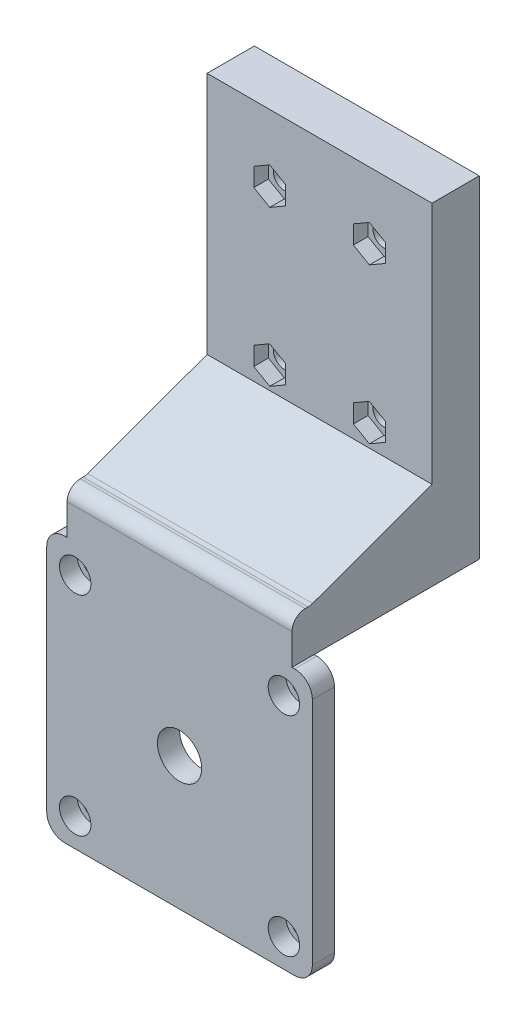
from build123d import *

# Parameters (mm, degrees)
SKETCH1_W           = 50.8
SKETCH1_H           = 65.000000038
SKETCH1_R           = 2.5
EXTRUDE_5_DEPTH     = 7.5
SKETCH1_3_W         = 50.8
SKETCH1_3_H         = 10
BOSS_EXTRUDE1_DEPTH = 34.125
BOSS_EXTRUDE2_START = 34.125
SKETCH1_4_R         = 2.25
BOSS_EXTRUDE2_DEPTH = 5
CHAMFER1_SIZE       = 10
CHAMFER1_SIZE2      = 27.474774195
FILLET1_R           = 3
SKETCH2_R           = 5
CUT_EXTRUDE1_DEPTH  = 144.721138443
SKETCH3_R           = 3.55
CUT_EXTRUDE2_DEPTH  = 4
CUT_EXTRUDE3_DEPTH  = 3.3
BOSS_EXTRUDE3_START = -3.18
SKETCH1_5_W         = 50.8
SKETCH1_5_H         = 65.000000038
SKETCH1_5_R         = 2.5
SKETCH1_5_H_2       = 10
BOSS_EXTRUDE3_DEPTH = 3.18


with BuildPart() as part:
    # Sketch1 → 5 (new body)
    with BuildSketch(Plane.XY):
        with Locations((0, 102.500000019)):
            Rectangle(SKETCH1_W, SKETCH1_H)
        with Locations((-11.25, 85.000000038)):
            Circle(SKETCH1_R, mode=Mode.SUBTRACT)
        with Locations((-11.25, 120.000000038)):
            Circle(SKETCH1_R, mode=Mode.SUBTRACT)
        with Locations((11.25, 85.000000038)):
            Circle(SKETCH1_R, mode=Mode.SUBTRACT)
        with Locations((11.25, 120.000000038)):
            Circle(SKETCH1_R, mode=Mode.SUBTRACT)
    extrude(amount=EXTRUDE_5_DEPTH)

    # Sketch1<3> → Boss-Extrude1 (add)
    with BuildSketch(Plane.XY):
        with Locations((0, 65)):
            Rectangle(SKETCH1_3_W, SKETCH1_3_H)
    extrude(amount=BOSS_EXTRUDE1_DEPTH)

    # Sketch1<4> → Boss-Extrude2 (add)
    with BuildSketch(Plane.XY.offset(BOSS_EXTRUDE2_START)):
        with BuildLine():
            Line((-25.4, 70), (-25.4, 60))
            Line((-25.4, 60), (-26, 60))
            ThreePointArc((-26, 60), (-28.828427125, 58.828427125), (-30, 56))
            Line((-30, 56), (-30, 4))
            ThreePointArc((-30, 4), (-28.828427125, 1.171572875), (-26, 0))
            Line((-26, 0), (26, 0))
            ThreePointArc((26, 0), (28.828427125, 1.171572875), (30, 4))
            Line((30, 4), (30, 56))
            ThreePointArc((30, 56), (28.828427125, 58.828427125), (26, 60))
            Line((26, 60), (25.4, 60))
            Line((25.4, 60), (25.4, 70))
            Line((25.4, 70), (-25.4, 70))
        make_face()
        with Locations((23.57, 53.57)):
            Circle(SKETCH1_4_R, mode=Mode.SUBTRACT)
        with Locations((-23.57, 6.43)):
            Circle(SKETCH1_4_R, mode=Mode.SUBTRACT)
        with Locations((-23.57, 53.57)):
            Circle(SKETCH1_4_R, mode=Mode.SUBTRACT)
        with Locations((23.57, 6.43)):
            Circle(SKETCH1_4_R, mode=Mode.SUBTRACT)
    extrude(amount=BOSS_EXTRUDE2_DEPTH)

    # Chamfer1
    chamfer1_edges = [part.edges().sort_by_distance(p)[0] for p in [
        (0, 70, 7.5),
    ]]
    chamfer1_side = [part.faces().sort_by_distance(p)[0] for p in [
        (0, 102.500000019, 7.5),
    ]]
    chamfer(chamfer1_edges, length=CHAMFER1_SIZE, length2=CHAMFER1_SIZE2, reference=chamfer1_side[0])

    # Fillet1
    fillet1_edges = [part.edges().sort_by_distance(p)[0] for p in [
        (0, 70, 39.125),
        (0, 70, 34.974774195),
    ]]
    fillet(fillet1_edges, radius=FILLET1_R)

    # Sketch2 → Cut-Extrude1 (cut, through all)
    with BuildSketch(Plane.XY.offset(39.125)):
        with Locations((0, 30)):
            Circle(SKETCH2_R)
    extrude(amount=-CUT_EXTRUDE1_DEPTH, mode=Mode.SUBTRACT)

    # Sketch3 → Cut-Extrude2 (cut)
    with BuildSketch(Plane.XY.offset(39.125)):
        with Locations((-23.57, 53.57)):
            Circle(SKETCH3_R)
        with Locations((23.57, 53.57)):
            Circle(SKETCH3_R)
        with Locations((-23.57, 6.43)):
            Circle(SKETCH3_R)
        with Locations((23.57, 6.43)):
            Circle(SKETCH3_R)
    extrude(amount=-CUT_EXTRUDE2_DEPTH, mode=Mode.SUBTRACT)

    # Sketch4 → Cut-Extrude3 (cut)
    with BuildSketch(Plane.XY.offset(7.5)):
        Polygon((-11.25, 124.156921976), (-14.85, 122.078461007), (-14.85, 117.921539069), (-11.25, 115.8430781), (-7.65, 117.921539069), (-7.65, 122.078461007), align=None)
        Polygon((11.25, 124.156921976), (7.65, 122.078461007), (7.65, 117.921539069), (11.25, 115.8430781), (14.85, 117.921539069), (14.85, 122.078461007), align=None)
        Polygon((-11.25, 89.156921976), (-14.85, 87.078461007), (-14.85, 82.921539069), (-11.25, 80.8430781), (-7.65, 82.921539069), (-7.65, 87.078461007), align=None)
        Polygon((11.25, 89.156921976), (7.65, 87.078461007), (7.65, 82.921539069), (11.25, 80.8430781), (14.85, 82.921539069), (14.85, 87.078461007), align=None)
    extrude(amount=-CUT_EXTRUDE3_DEPTH, mode=Mode.SUBTRACT)

    # Sketch1<5> → Boss-Extrude3 (add)
    # profile 1 of 2: a face of its own
    with BuildSketch(Plane.XY.offset(BOSS_EXTRUDE3_START)):
        with Locations((0, 102.500000019)):
            Rectangle(SKETCH1_5_W, SKETCH1_5_H)
        with Locations((-11.25, 85.000000038)):
            Circle(SKETCH1_5_R, mode=Mode.SUBTRACT)
        with Locations((-11.25, 120.000000038)):
            Circle(SKETCH1_5_R, mode=Mode.SUBTRACT)
        with Locations((11.25, 85.000000038)):
            Circle(SKETCH1_5_R, mode=Mode.SUBTRACT)
        with Locations((11.25, 120.000000038)):
            Circle(SKETCH1_5_R, mode=Mode.SUBTRACT)
    # profile 2 of 2: a face of its own
    with BuildSketch(Plane.XY.offset(BOSS_EXTRUDE3_START)):
        with Locations((0, 65)):
            Rectangle(SKETCH1_5_W, SKETCH1_5_H_2)
    extrude(amount=BOSS_EXTRUDE3_DEPTH)


solid = part.part
